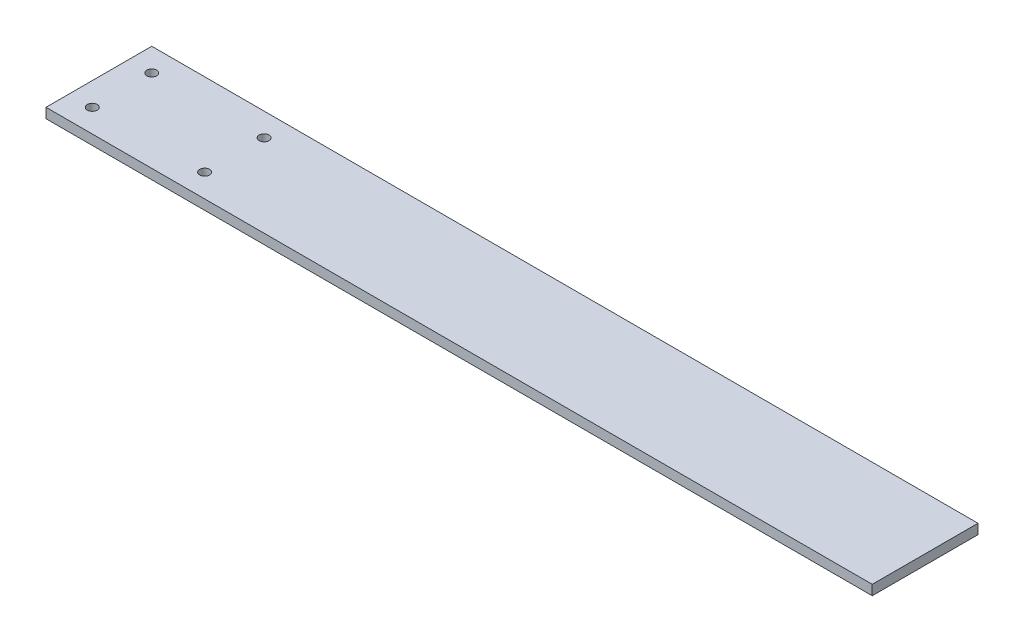
from build123d import *

# Parameters (mm, degrees)
SKETCH1_W           = 250
SKETCH1_H           = 32
SKETCH1_R           = 1.5
BOSS_EXTRUDE1_DEPTH = 3


with BuildPart() as part:
    # Sketch1 → Boss-Extrude1 (new body)
    with BuildSketch(Plane(origin=(0, 0, 0), x_dir=(1, 0, 0), z_dir=(0, 1, 0))):
        Rectangle(SKETCH1_W, SKETCH1_H)
        with Locations(Location((-118, 9, 0), (0, 0, 270))):
            Circle(SKETCH1_R, mode=Mode.SUBTRACT)
        with Locations(Location((-118, -9, 0), (0, 0, 270))):
            Circle(SKETCH1_R, mode=Mode.SUBTRACT)
        with Locations(Location((-84, -9, 0), (0, 0, 270))):
            Circle(SKETCH1_R, mode=Mode.SUBTRACT)
        with Locations(Location((-84, 9, 0), (0, 0, 270))):
            Circle(SKETCH1_R, mode=Mode.SUBTRACT)
    extrude(amount=BOSS_EXTRUDE1_DEPTH)


solid = part.part
